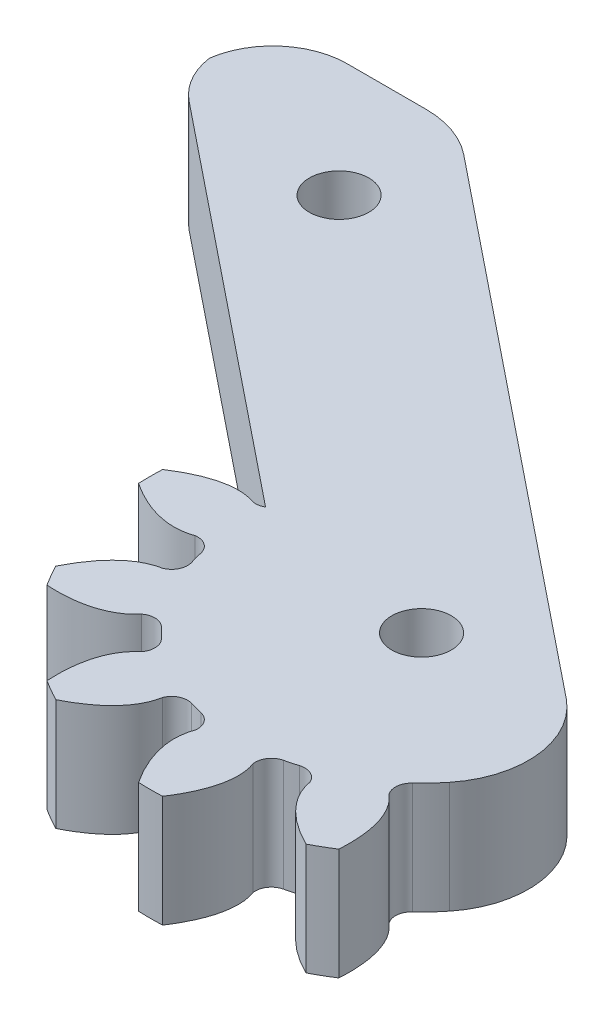
from build123d import *

# Parameters (mm, degrees)
RESSALTO_EXTRUS_O1_DEPTH = 6
CORTE_EXTRUS_O1_DEPTH    = 63.752949305
CORTE_EXTRUS_O2_DEPTH    = 63.752949305
CORTE_EXTRUS_O3_DEPTH    = 63.752949305
CORTE_EXTRUS_O4_DEPTH    = 63.752949305
ESBO_O6_R                = 1.6
CORTE_EXTRUS_O5_DEPTH    = 63.752949305
ESBO_O7_R                = 1.6
CORTE_EXTRUS_O6_DEPTH    = 63.752949305


with BuildPart() as part:
    # Esboço1 → Ressalto-extrusão1 (new body)
    with BuildSketch(Plane.XZ.offset(6)):
        with BuildLine():
            Line((-35.053391166, -1.665767354), (-56.005959689, -18.507024557))
            ThreePointArc((-56.005959689, -18.507024557), (-56.976417823, -19.646228266), (-57.460270003, -21.062371319))
            ThreePointArc((-57.460270003, -21.062371319), (-56.122071197, -23.520718894), (-53.5, -24.5))
            Line((-53.5, -24.5), (-49.26036734, -24.5))
            ThreePointArc((-49.26036734, -24.5), (-47.599906261, -24.216234622), (-46.127917729, -23.397147602))
            Line((-46.127917729, -23.397147602), (-18.051593362, -0.829957358))
            ThreePointArc((-18.051593362, -0.829957358), (-16.213367114, 2.526467109), (-17.286895371, 6.199639856))
            ThreePointArc((-17.286895371, 6.199639856), (-17.752824847, 6.738395184), (-18.256300836, 7.242239912))
            ThreePointArc((-18.256300836, 7.242239912), (-18.528297677, 7.80831066), (-18.343735303, 8.408606506))
            add(Edge.make_bspline(
                [(-18.343735303, 8.408606506), (-16.98173735, 9.54416389), (-17.156613946, 12.29450716)],
                knots=[0.078549619, 0.078549619, 0.078549619, 0.770539159, 0.770539159, 0.770539159], degree=2, weights=[1, 0.940738559, 1]))
            ThreePointArc((-17.156613946, 12.29450716), (-32.291666667, 12.629537139), (-39.569048555, -0.645317995))
            add(Edge.make_bspline(
                [(-39.569048555, -0.645317995), (-37.274619711, -2.171937204), (-35.610199193, -1.560191069)],
                knots=[2.371053495, 2.371053495, 2.371053495, 3.063043035, 3.063043035, 3.063043035], degree=2, weights=[1, 0.940738559, 1]))
            ThreePointArc((-35.610199193, -1.560191069), (-35.322864942, -1.565881251), (-35.053391166, -1.665767354))
        make_face()
    extrude(amount=-RESSALTO_EXTRUS_O1_DEPTH)

    # Esboço2 → Corte-extrusão1 (cut, through all)
    with BuildSketch(Plane(origin=(0, 0, 0), x_dir=(-1, 0, 0), z_dir=(0, 1, 0))):
        with BuildLine():
            ThreePointArc((24.354682005, 14.569048555), (21.225555592, 14.0864183), (18.274337499, 12.939825155))
            add(Edge.make_bspline(
                [(21.046065504, 9.968797575), (20.743642938, 11.716101094), (18.274337499, 12.939825155)],
                knots=[3.220142273, 3.220142273, 3.220142273, 3.912131812, 3.912131812, 3.912131812], degree=2, weights=[1, 0.940738559, 1]))
            ThreePointArc((21.046065504, 9.968797575), (21.47365577, 9.508813947), (22.099885838, 9.461334748))
            ThreePointArc((22.099885838, 9.461334748), (22.438769866, 9.558640989), (22.780905164, 9.643813326))
            ThreePointArc((22.780905164, 9.643813326), (23.299496712, 9.998046554), (23.439808931, 10.610199193))
            add(Edge.make_bspline(
                [(24.354682005, 14.569048555), (22.828062796, 12.274619711), (23.439808931, 10.610199193)],
                knots=[2.371053495, 2.371053495, 2.371053495, 3.063043035, 3.063043035, 3.063043035], degree=2, weights=[1, 0.940738559, 1]))
        make_face()
    extrude(amount=-CORTE_EXTRUS_O1_DEPTH, mode=Mode.SUBTRACT)

    # Esboço3 → Corte-extrusão2 (cut, through all)
    with BuildSketch(Plane(origin=(0, 0, 0), x_dir=(-1, 0, 0), z_dir=(0, 1, 0))):
        with BuildLine():
            ThreePointArc((31.725662501, 12.939825155), (28.774444408, 14.0864183), (25.645317995, 14.569048555))
            add(Edge.make_bspline(
                [(26.560191069, 10.610199193), (27.171937204, 12.274619711), (25.645317995, 14.569048555)],
                knots=[3.220142273, 3.220142273, 3.220142273, 3.912131812, 3.912131812, 3.912131812], degree=2, weights=[1, 0.940738559, 1]))
            ThreePointArc((26.560191069, 10.610199193), (26.700503288, 9.998046554), (27.219094836, 9.643813326))
            ThreePointArc((27.219094836, 9.643813326), (27.561230134, 9.558640989), (27.900114162, 9.461334748))
            ThreePointArc((27.900114162, 9.461334748), (28.52634423, 9.508813947), (28.953934496, 9.968797575))
            add(Edge.make_bspline(
                [(31.725662501, 12.939825155), (29.256357062, 11.716101094), (28.953934496, 9.968797575)],
                knots=[2.371053495, 2.371053495, 2.371053495, 3.063043035, 3.063043035, 3.063043035], degree=2, weights=[1, 0.940738559, 1]))
        make_face()
    extrude(amount=-CORTE_EXTRUS_O2_DEPTH, mode=Mode.SUBTRACT)

    # Esboço4 → Corte-extrusão3 (cut, through all)
    with BuildSketch(Plane(origin=(0, 0, 0), x_dir=(-1, 0, 0), z_dir=(0, 1, 0))):
        with BuildLine():
            ThreePointArc((37.29450716, 7.843386054), (35.311973892, 10.311973892), (32.843386054, 12.29450716))
            add(Edge.make_bspline(
                [(31.656264697, 8.408606506), (33.01826265, 9.54416389), (32.843386054, 12.29450716)],
                knots=[3.220142273, 3.220142273, 3.220142273, 3.912131812, 3.912131812, 3.912131812], degree=2, weights=[1, 0.940738559, 1]))
            ThreePointArc((31.656264697, 8.408606506), (31.471702323, 7.80831066), (31.743699164, 7.242239912))
            ThreePointArc((31.743699164, 7.242239912), (31.997410855, 6.997410855), (32.242239912, 6.743699164))
            ThreePointArc((32.242239912, 6.743699164), (32.80831066, 6.471702323), (33.408606506, 6.656264697))
            add(Edge.make_bspline(
                [(37.29450716, 7.843386054), (34.54416389, 8.01826265), (33.408606506, 6.656264697)],
                knots=[5.512646149, 5.512646149, 5.512646149, 6.204635688, 6.204635688, 6.204635688], degree=2, weights=[1, 0.940738559, 1]))
        make_face()
    extrude(amount=-CORTE_EXTRUS_O3_DEPTH, mode=Mode.SUBTRACT)

    # Esboço5 → Corte-extrusão4 (cut, through all)
    with BuildSketch(Plane(origin=(0, 0, 0), x_dir=(-1, 0, 0), z_dir=(0, 1, 0))):
        with BuildLine():
            ThreePointArc((39.569048555, 0.645317995), (39.0864183, 3.774444408), (37.939825155, 6.725662501))
            add(Edge.make_bspline(
                [(34.968797575, 3.953934496), (36.716101094, 4.256357062), (37.939825155, 6.725662501)],
                knots=[3.220142273, 3.220142273, 3.220142273, 3.912131812, 3.912131812, 3.912131812], degree=2, weights=[1, 0.940738559, 1]))
            ThreePointArc((34.968797575, 3.953934496), (34.508813947, 3.52634423), (34.461334748, 2.900114162))
            ThreePointArc((34.461334748, 2.900114162), (34.558640989, 2.561230134), (34.643813326, 2.219094836))
            ThreePointArc((34.643813326, 2.219094836), (34.998046554, 1.700503288), (35.610199193, 1.560191069))
            add(Edge.make_bspline(
                [(39.569048555, 0.645317995), (37.274619711, 2.171937204), (35.610199193, 1.560191069)],
                knots=[2.371053495, 2.371053495, 2.371053495, 3.063043035, 3.063043035, 3.063043035], degree=2, weights=[1, 0.940738559, 1]))
        make_face()
    extrude(amount=-CORTE_EXTRUS_O4_DEPTH, mode=Mode.SUBTRACT)

    # Esboço6 → Corte-extrusão5 (cut, through all)
    with BuildSketch(Plane.XZ.offset(6)):
        with Locations(Location((-25, 0, 0), (0, 0, 270))):
            Circle(ESBO_O6_R)
    extrude(amount=-CORTE_EXTRUS_O5_DEPTH, mode=Mode.SUBTRACT)

    # Esboço7 → Corte-extrusão6 (cut, through all)
    with BuildSketch(Plane(origin=(0, 0, 0), x_dir=(-1, 0, 0), z_dir=(0, 1, 0))):
        with Locations(Location((47.598401843, -18.16414524, 0), (0, 0, 270))):
            Circle(ESBO_O7_R)
    extrude(amount=-CORTE_EXTRUS_O6_DEPTH, mode=Mode.SUBTRACT)


solid = part.part
